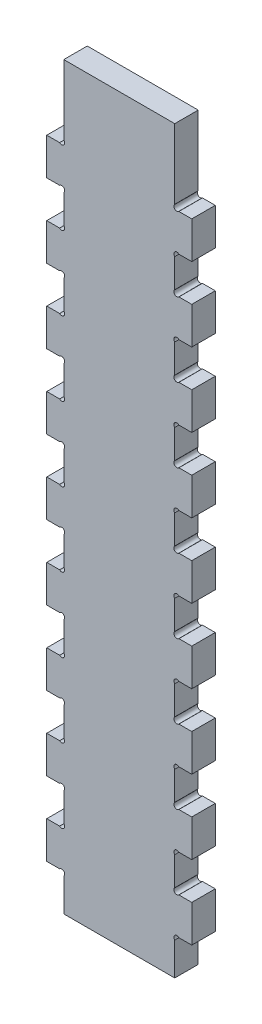
from build123d import *

# Parameters (mm, degrees)
SKETCH1_W           = 29.9974
SKETCH1_H           = 200
BOSS_EXTRUDE1_DEPTH = 6.35
SKETCH2_W           = 4.6
SKETCH2_H           = 10
BOSS_EXTRUDE2_DEPTH = 6.35
LPATTERN1_COUNT     = 9
LPATTERN1_PITCH     = 20
DOGBONE01_D         = 1.5875
DOGBONE02_D         = 1.5875
LPATTERN2_COUNT     = 9
LPATTERN2_PITCH     = 20
LPATTERN4_COUNT     = 9
LPATTERN4_PITCH     = 20


with BuildPart() as part:
    # Sketch1 → Boss-Extrude1 (new body)
    with BuildSketch(Plane.XY):
        Rectangle(SKETCH1_W, SKETCH1_H)
    extrude(amount=BOSS_EXTRUDE1_DEPTH)

    # Sketch2 → Boss-Extrude2 (add)
    with BuildSketch(Plane.XY):
        with Locations((-17.2987, -85)):
            Rectangle(SKETCH2_W, SKETCH2_H)
        with Locations((17.2987, -85)):
            Rectangle(SKETCH2_W, SKETCH2_H)
    boss_extrude2 = extrude(amount=BOSS_EXTRUDE2_DEPTH)

    # LPattern1: Boss-Extrude2 ×9
    with Locations(*[(0, i * LPATTERN1_PITCH, 0) for i in range(1, LPATTERN1_COUNT)]):
        add(boss_extrude2)

    # dogBone01 (through all)
    with Locations(Plane.XY.offset(6.35)):
        with Locations((15.559966008, -90.561266008), (-15.559966008, -90.561266008)):
            dogbone01 = Hole(DOGBONE01_D / 2)

    # dogBone02 (through all)
    with Locations(Plane.XY.offset(6.35)):
        with Locations((15.559966008, -79.438733992), (-15.559966008, -79.438733992)):
            dogbone02 = Hole(DOGBONE02_D / 2)

    # LPattern2: dogBone01 ×9
    with Locations(*[(0, i * LPATTERN2_PITCH, 0) for i in range(1, LPATTERN2_COUNT)]):
        add(dogbone01, mode=Mode.SUBTRACT)

    # LPattern4: dogBone02 ×9
    with Locations(*[(0, i * LPATTERN4_PITCH, 0) for i in range(1, LPATTERN4_COUNT)]):
        add(dogbone02, mode=Mode.SUBTRACT)


solid = part.part
